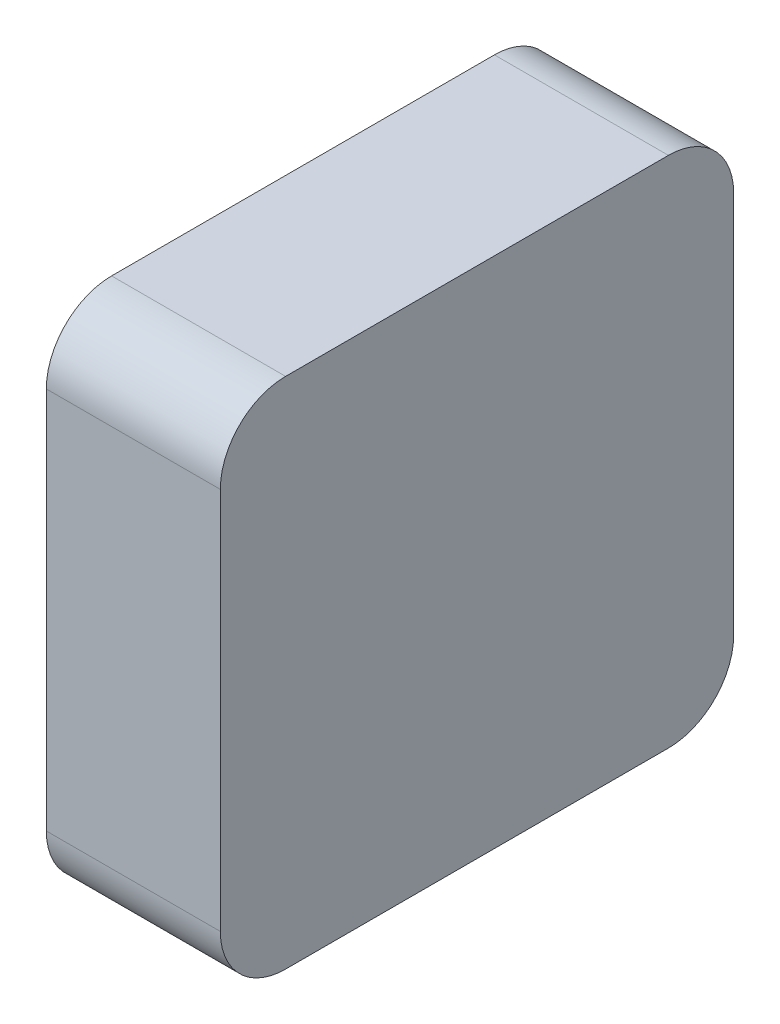
from build123d import *

# Parameters (mm, degrees)
BOSS_EXTRUDE1_DEPTH = 10.16


with BuildPart() as part:
    # Sketch1 → Boss-Extrude1 (new body)
    with BuildSketch(Plane.YZ):
        with BuildLine():
            Line((-11.176, -14.986), (11.176, -14.986))
            ThreePointArc((11.176, -14.986), (13.870076836, -13.870076836), (14.986, -11.176))
            Line((14.986, -11.176), (14.986, 11.176))
            ThreePointArc((14.986, 11.176), (13.870076836, 13.870076836), (11.176, 14.986))
            Line((11.176, 14.986), (-11.176, 14.986))
            ThreePointArc((-11.176, 14.986), (-13.870076836, 13.870076836), (-14.986, 11.176))
            Line((-14.986, 11.176), (-14.986, -11.176))
            ThreePointArc((-14.986, -11.176), (-13.870076836, -13.870076836), (-11.176, -14.986))
        make_face()
    extrude(amount=BOSS_EXTRUDE1_DEPTH)


solid = part.part
